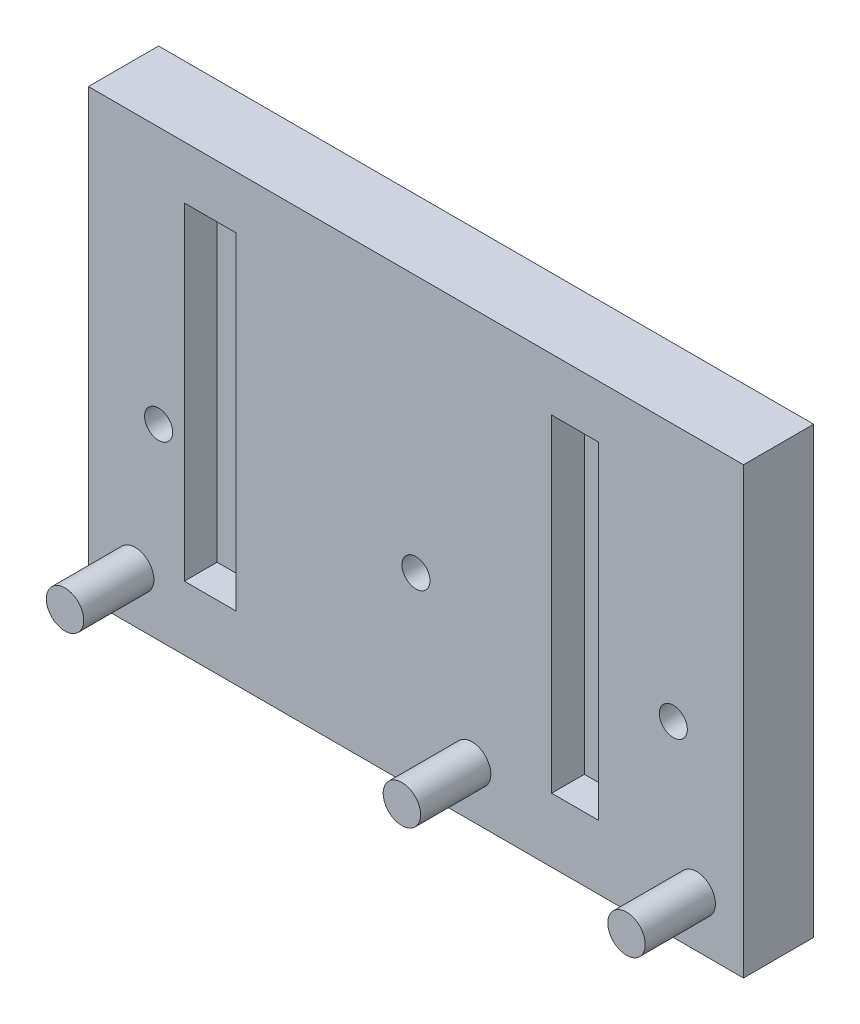
from build123d import *

# Parameters (mm, degrees)
SKETCH1_W                = 92
SKETCH1_H                = 77
SKETCH1_R                = 4
BOSS_EXTRUDE1_DEPTH      = 15
BOSS_EXTRUDE2_DEPTH      = 15
BOSS_EXTRUDE2_DEPTH_BACK = 15
SKETCH1_3_R              = 4
SKETCH2_R                = 3
CUT_EXTRUDE1_DEPTH       = 953.668300138
SKETCH2_3_W              = 11
SKETCH2_3_H              = 70
SKETCH2_3_W_2            = 10
CUT_EXTRUDE2_DEPTH       = 7


with BuildPart() as part:
    # Sketch1 → Boss-Extrude1 (new body)
    # profile 1 of 3: a face of its own
    with BuildSketch(Plane.XY):
        with Locations((123.683888311, -870.843310138)):
            Rectangle(SKETCH1_W, SKETCH1_H)
    # profile 2 of 3: a face of its own
    with BuildSketch(Plane.XY):
        Polygon((169.683888311, -927.343310138), (217.683888311, -927.343310138), (217.683888311, -832.343310138), (169.683888311, -832.343310138), (169.683888311, -920.343310138), align=None)
        with Locations((207.683888311, -916.643310138)):
            Circle(SKETCH1_R, mode=Mode.SUBTRACT)
    # profile 3 of 3: a face of its own
    with BuildSketch(Plane.XY):
        Polygon((77.683888311, -909.343310138), (77.683888311, -920.343310138), (77.683888311, -927.343310138), (169.683888311, -927.343310138), (169.683888311, -920.343310138), (169.683888311, -909.343310138), align=None)
        with Locations((87.683888311, -916.643310138)):
            Circle(SKETCH1_R, mode=Mode.SUBTRACT)
        with Locations((159.683888311, -916.643310138)):
            Circle(SKETCH1_R, mode=Mode.SUBTRACT)
    extrude(amount=-BOSS_EXTRUDE1_DEPTH)

    # Sketch1<3> → Boss-Extrude2 (add, two sides: drawn at the far end of the back side and taken through both)
    with BuildSketch(Plane.XY.offset(-BOSS_EXTRUDE2_DEPTH_BACK)):
        with Locations((87.683888311, -916.643310138)):
            Circle(SKETCH1_3_R)
        with Locations((207.683888311, -916.643310138)):
            Circle(SKETCH1_3_R)
        with Locations((159.683888311, -916.643310138)):
            Circle(SKETCH1_3_R)
    extrude(amount=BOSS_EXTRUDE2_DEPTH + BOSS_EXTRUDE2_DEPTH_BACK)

    # Sketch2 → Cut-Extrude1 (cut, through all)
    with BuildSketch(Plane.XY):
        with Locations((147.683888311, -887.343310138)):
            Circle(SKETCH2_R)
        with Locations((202.683888311, -887.343310138)):
            Circle(SKETCH2_R)
        with Locations((92.683888311, -887.343310138)):
            Circle(SKETCH2_R)
    extrude(amount=-CUT_EXTRUDE1_DEPTH, mode=Mode.SUBTRACT)

    # Sketch2<3> → Cut-Extrude2 (cut)
    with BuildSketch(Plane.XY):
        with Locations((103.683888311, -878.643310138)):
            Rectangle(SKETCH2_3_W, SKETCH2_3_H)
        with Locations((181.683888311, -878.643310138)):
            Rectangle(SKETCH2_3_W_2, SKETCH2_3_H)
    extrude(amount=-CUT_EXTRUDE2_DEPTH, mode=Mode.SUBTRACT)


solid = part.part
